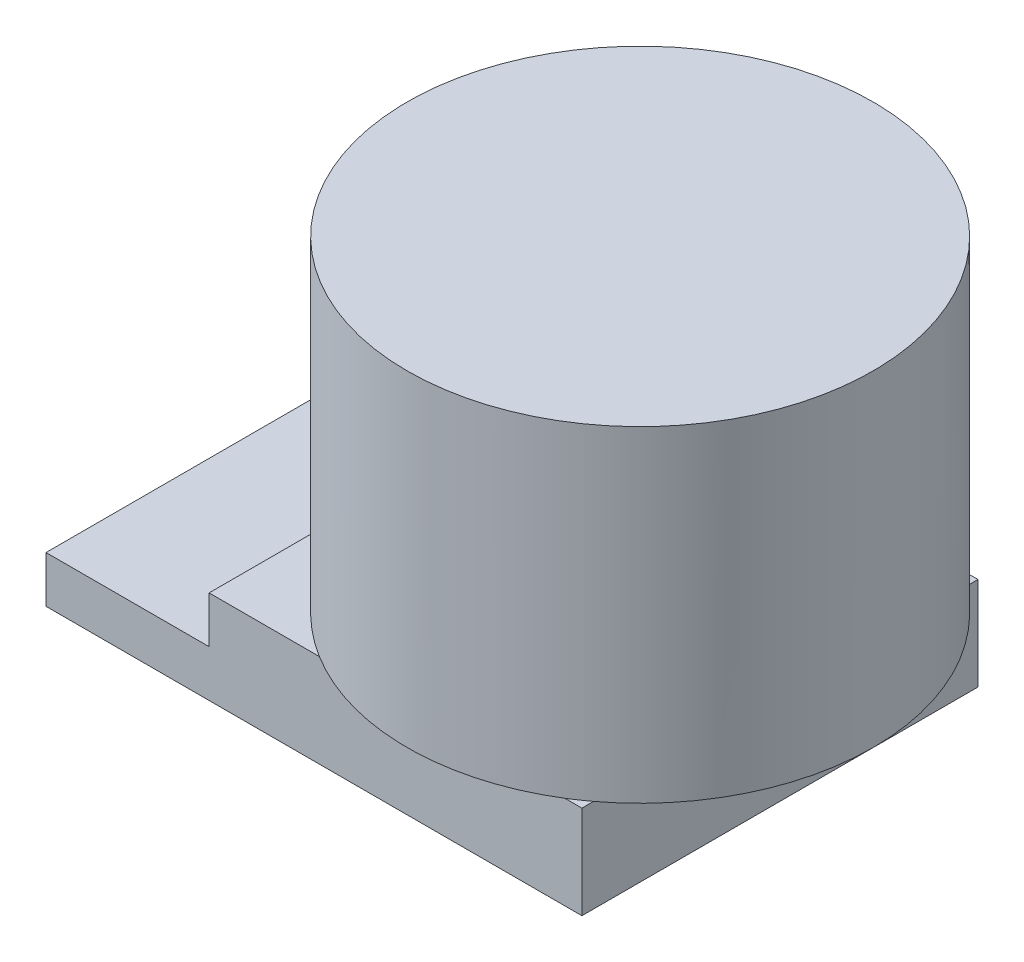
from build123d import *

# Parameters (mm, degrees)
SKETCH1_W           = 11.5
SKETCH1_H           = 8.5
BOSS_EXTRUDE1_DEPTH = 2
SKETCH2_R           = 5
BOSS_EXTRUDE2_DEPTH = 7
SKETCH3_W           = 3.5
SKETCH3_H           = 8.5
CUT_EXTRUDE1_DEPTH  = 1


with BuildPart() as part:
    # Sketch1 → Boss-Extrude1 (new body)
    with BuildSketch(Plane(origin=(0, 0, 0), x_dir=(1, 0, 0), z_dir=(0, 1, 0))):
        Rectangle(SKETCH1_W, SKETCH1_H)
    extrude(amount=BOSS_EXTRUDE1_DEPTH)

    # Sketch2 → Boss-Extrude2 (add)
    with BuildSketch(Plane(origin=(0, 2, 0), x_dir=(1, 0, 0), z_dir=(0, 1, 0))):
        with Locations(Location((2.75, 0, 0), (0, 0, 58.211669383))):
            Circle(SKETCH2_R)
    extrude(amount=BOSS_EXTRUDE2_DEPTH)

    # Sketch3 → Cut-Extrude1 (cut)
    with BuildSketch(Plane(origin=(0, 2, 0), x_dir=(1, 0, 0), z_dir=(0, 1, 0))):
        with Locations((-4, 0)):
            Rectangle(SKETCH3_W, SKETCH3_H)
    extrude(amount=-CUT_EXTRUDE1_DEPTH, mode=Mode.SUBTRACT)


solid = part.part
